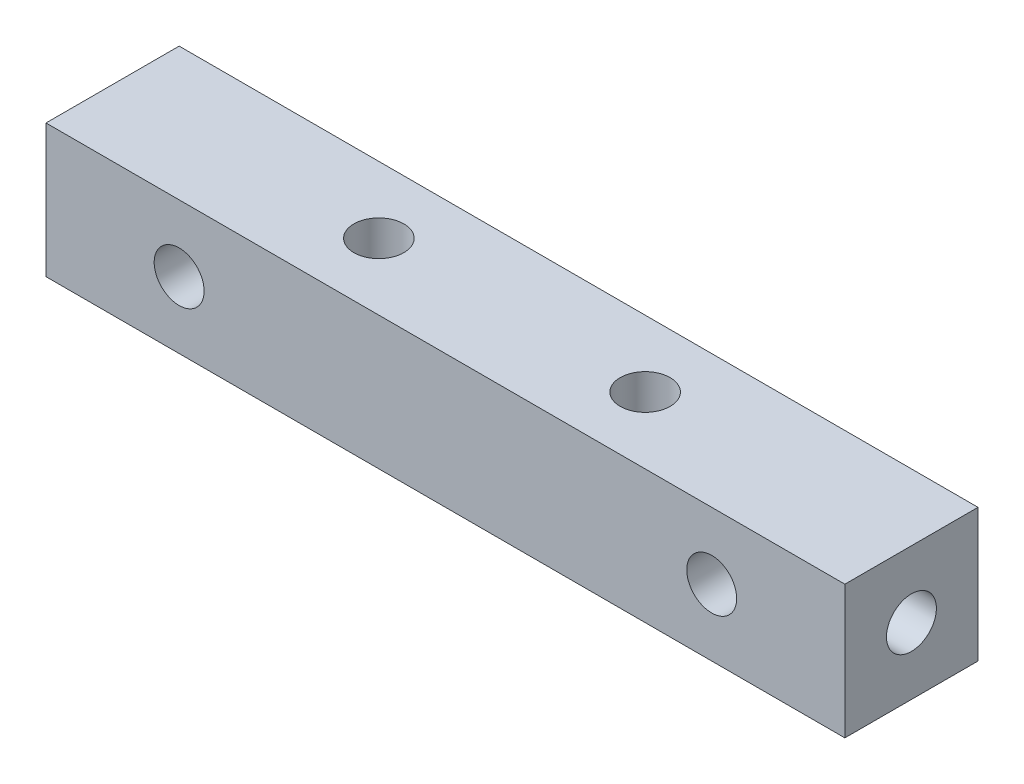
from build123d import *

# Parameters (mm, degrees)
SKETCH_1_W          = 48
SKETCH_1_H          = 8
EXTRUDE_1_DEPTH     = 8
SKETCH_2_R          = 1.5
CUT_EXTRUDE_1_DEPTH = 10
SKETCH_3_R          = 1.5
CUT_EXTRUDE_2_DEPTH = 10
SKETCH_4_R          = 1.5
CUT_EXTRUDE_3_DEPTH = 8


with BuildPart() as part:
    # 草图1 → 凸台-拉伸1 (new body)
    with BuildSketch(Plane(origin=(0, 0, 0), x_dir=(1, 0, 0), z_dir=(0, 1, 0))):
        Rectangle(SKETCH_1_W, SKETCH_1_H)
    extrude(amount=EXTRUDE_1_DEPTH)

    # 草图2 → 切除-拉伸1 (cut)
    with BuildSketch(Plane.XY.offset(4)):
        with Locations((-16, 4)):
            Circle(SKETCH_2_R)
        with Locations((16, 4)):
            Circle(SKETCH_2_R)
    extrude(amount=-CUT_EXTRUDE_1_DEPTH, mode=Mode.SUBTRACT)

    # 草图3 → 切除-拉伸2 (cut)
    with BuildSketch(Plane(origin=(0, 8, 0), x_dir=(1, 0, 0), z_dir=(0, 1, 0))):
        with Locations(Location((-8, 0, 0), (0, 0, 270))):
            Circle(SKETCH_3_R)
        with Locations(Location((8, 0, 0), (0, 0, 270))):
            Circle(SKETCH_3_R)
    extrude(amount=-CUT_EXTRUDE_2_DEPTH, mode=Mode.SUBTRACT)

    # 草图4 → 切除-拉伸3 (cut)
    with BuildSketch(Plane.ZY.offset(24)):
        with Locations((0, 4)):
            Circle(SKETCH_4_R)
    cut_extrude_3 = extrude(amount=-CUT_EXTRUDE_3_DEPTH, mode=Mode.SUBTRACT)

    # 镜向1: 切除-拉伸3 across plane
    add(cut_extrude_3.mirror(Plane(origin=(0, 0, 0), x_dir=(0, 0, 1), z_dir=(1, 0, 0))), mode=Mode.SUBTRACT)


solid = part.part
